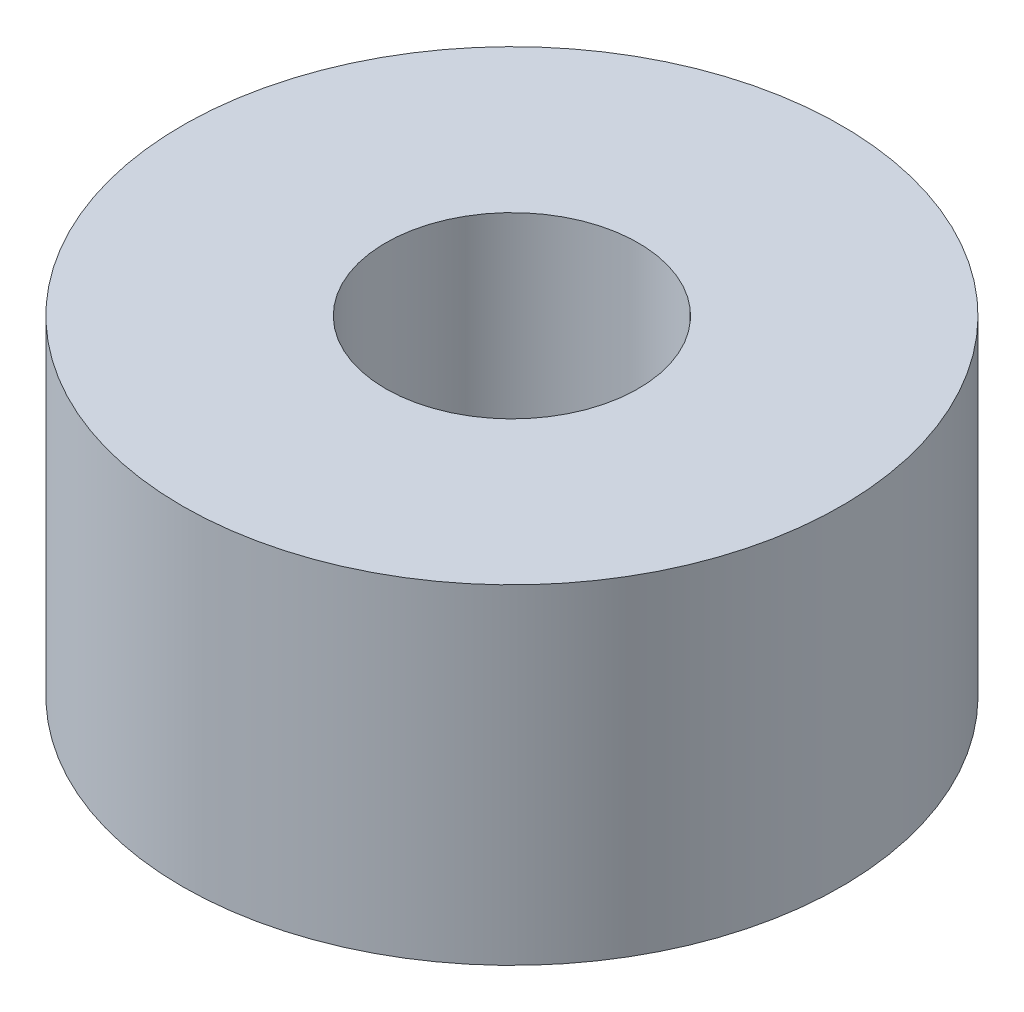
from build123d import *

# Parameters (mm, degrees)
SKETCH_1_R      = 3
SKETCH_1_R_2    = 1.15
EXTRUDE_1_DEPTH = 3


with BuildPart() as part:
    # 草图1 → 凸台-拉伸1 (new body)
    with BuildSketch(Plane(origin=(0, 0, 0), x_dir=(1, 0, 0), z_dir=(0, 1, 0))):
        with Locations(Location((0, 0, 0), (0, 0, 270))):
            Circle(SKETCH_1_R)
        with Locations(Location((0, 0, 0), (0, 0, 270))):
            Circle(SKETCH_1_R_2, mode=Mode.SUBTRACT)
    extrude(amount=EXTRUDE_1_DEPTH)


solid = part.part
